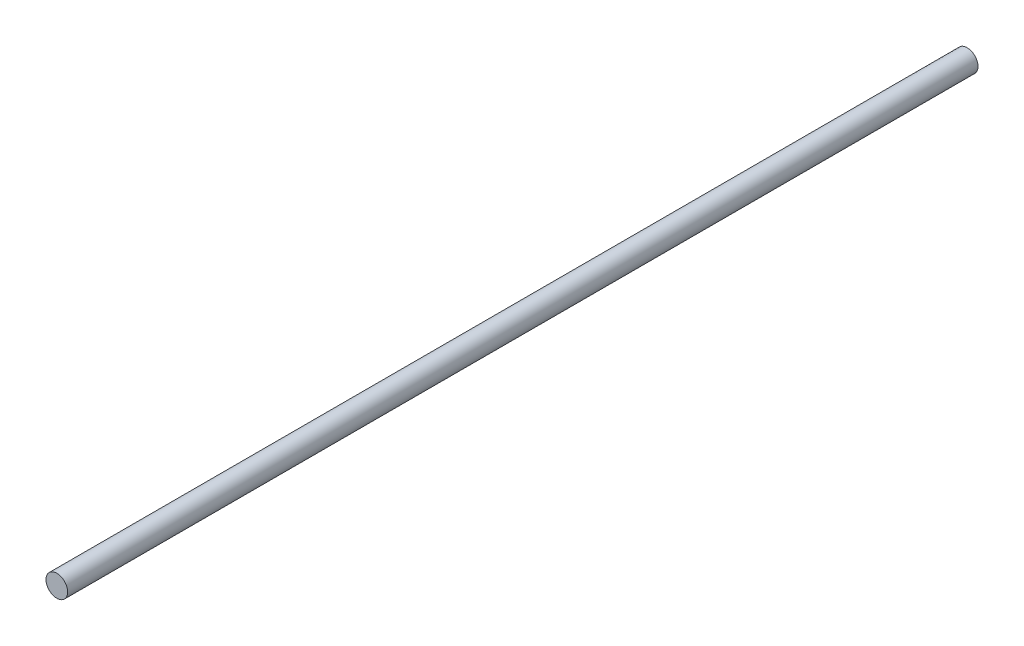
from build123d import *

# Parameters (mm, degrees)
SKETCH_1_R      = 6
EXTRUDE_1_DEPTH = 504


with BuildPart() as part:
    # Эскиз1 → Бобышка-Вытянуть1 (new body)
    with BuildSketch(Plane.XY):
        Circle(SKETCH_1_R)
    extrude(amount=-EXTRUDE_1_DEPTH)


solid = part.part
